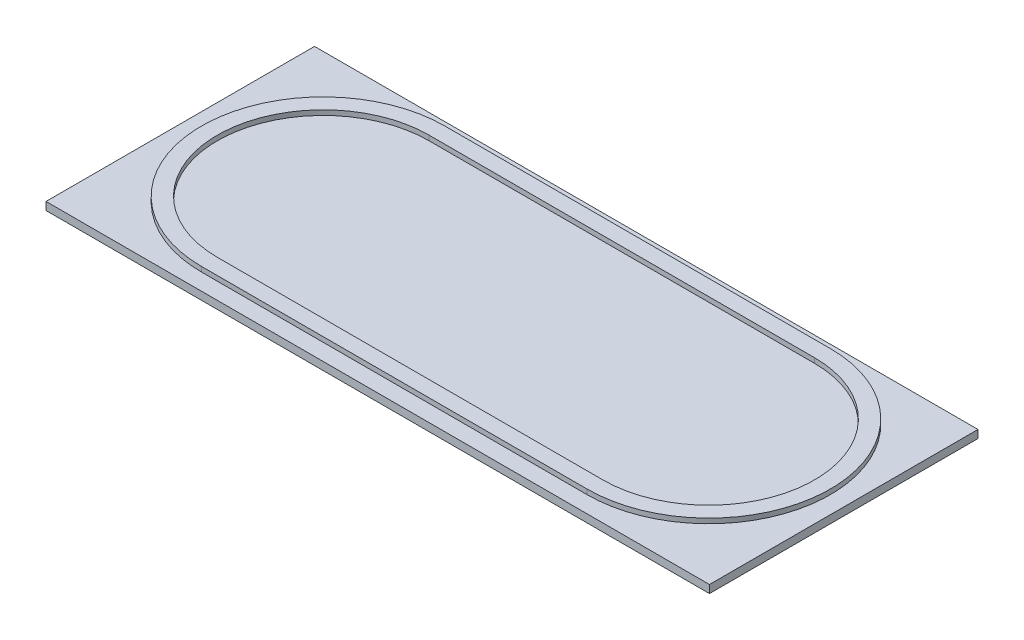
from build123d import *

# Parameters (mm, degrees)
TRAIN_TRACK_DEPTH   = 7.874
TRACK_BASE_SKETCH_W = 1066.8
TRACK_BASE_SKETCH_H = 431.8
TRACK_BASE_DEPTH    = 12.7


with BuildPart() as part:
    # Track Sketch → Train Track (new body)
    with BuildSketch(Plane(origin=(0, 0, 0), x_dir=(1, 0, 0), z_dir=(0, 1, 0))):
        with BuildLine():
            Line((-310, -195.58), (310, -195.58))
            ThreePointArc((310, -195.58), (505.58, 0), (310, 195.58))
            Line((310, 195.58), (-310, 195.58))
            ThreePointArc((-310, 195.58), (-505.58, 0), (-310, -195.58))
        make_face()
        with BuildLine():
            Line((-310, -170.18), (310, -170.18))
            ThreePointArc((310, -170.18), (480.18, 0), (310, 170.18))
            Line((310, 170.18), (-310, 170.18))
            ThreePointArc((-310, 170.18), (-480.18, 0), (-310, -170.18))
        make_face(mode=Mode.SUBTRACT)
    extrude(amount=TRAIN_TRACK_DEPTH)

    # Track Base Sketch → Track Base (add)
    with BuildSketch(Plane(origin=(0, 0, 0), x_dir=(1, 0, 0), z_dir=(0, 1, 0))):
        with Locations((0, -6.35)):
            Rectangle(TRACK_BASE_SKETCH_W, TRACK_BASE_SKETCH_H)
    extrude(amount=-TRACK_BASE_DEPTH)


solid = part.part
